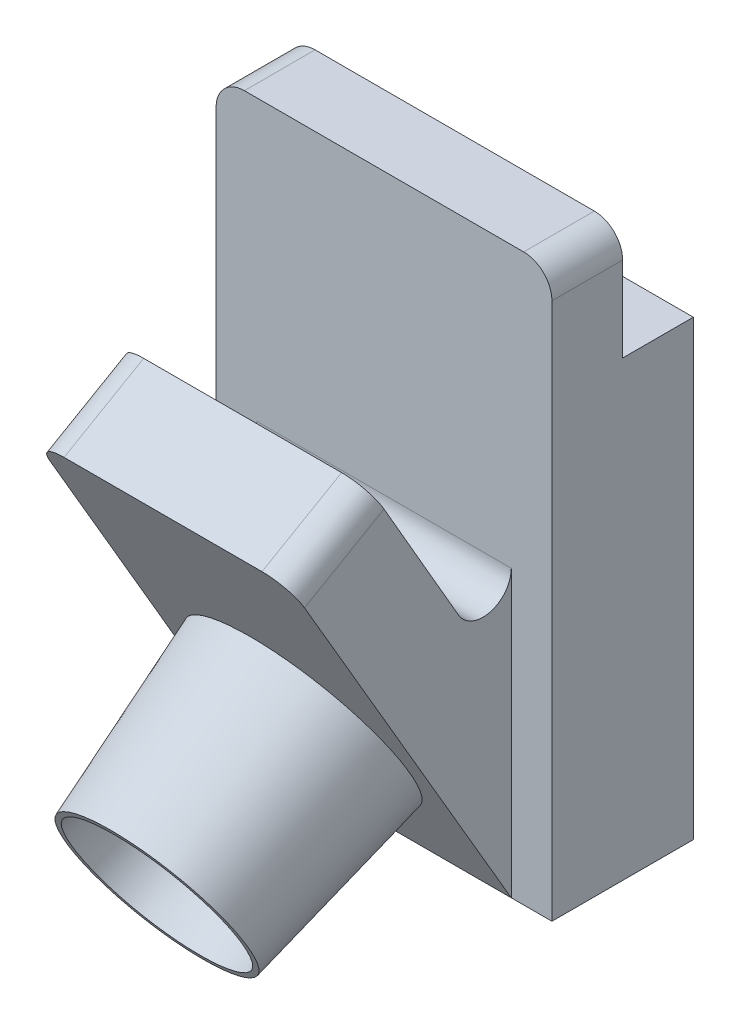
from build123d import *

# Parameters (mm, degrees)
SKETCH2_W           = 23.75
SKETCH2_H           = 32
BOSS_EXTRUDE1_DEPTH = 5
SKETCH3_W           = 23.75
SKETCH3_H           = 40
BOSS_EXTRUDE2_DEPTH = 5
BOSS_EXTRUDE3_START = -11.875
BOSS_EXTRUDE3_DEPTH = 9
SKETCH5_R           = 7.5
SKETCH5_R_2         = 5
BOSS_EXTRUDE4_DEPTH = 12
BOSS_EXTRUDE4_DRAFT = 5
SKETCH6_R           = 5
BOSS_EXTRUDE5_DEPTH = 5
BOSS_EXTRUDE5_TAPER = 45
FILLET1_R           = 2


with BuildPart() as part:
    # Sketch2 → Boss-Extrude1 (new body)
    with BuildSketch(Plane.XY):
        Rectangle(SKETCH2_W, SKETCH2_H)
    extrude(amount=-BOSS_EXTRUDE1_DEPTH)

    # Sketch3 → Boss-Extrude2 (add)
    with BuildSketch(Plane.XY):
        with Locations((0, 4)):
            Rectangle(SKETCH3_W, SKETCH3_H)
    extrude(amount=BOSS_EXTRUDE2_DEPTH)

    # Sketch4 → Boss-Extrude3 (add, symmetric)
    with BuildSketch(Plane(origin=(11.875, 0, 0), x_dir=(0, 0, -1), z_dir=(1, 0, 0)).offset(BOSS_EXTRUDE3_START)):
        Polygon((-5, -3.277778494), (-15, 14.042729581), (-20.629165125, 10.792729581), (-5, -16), align=None)
    extrude(amount=BOSS_EXTRUDE3_DEPTH, both=True)


with BuildPart() as boss_extrude4_tool:
    # Sketch5 → Boss-Extrude4 (with draft: the straight prism first)
    with BuildSketch(Plane(origin=(0, -6.238375225, 10.694307668), x_dir=(1, 0, 0), z_dir=(0, -0.50387277832175, 0.863777878430746))):
        Circle(SKETCH5_R)
        Circle(SKETCH5_R_2, mode=Mode.SUBTRACT)
    extrude(amount=BOSS_EXTRUDE4_DEPTH)
    # Boss-Extrude4: the draft: its side faces are tilted about the plane it starts from
    boss_extrude4_sides = [boss_extrude4_tool.faces().sort_by_distance(p)[0] for p in [
        (-7.5, -9.261611895, 15.876974938),
        (-5, -9.261611895, 15.876974938),
    ]]
    draft(boss_extrude4_sides, Plane(origin=(0, -6.238375225, 10.694307668), x_dir=(1, 0, 0), z_dir=(0, -0.50387277832175, 0.863777878430746)), BOSS_EXTRUDE4_DRAFT)


with BuildPart() as part_1:
    add(part.part)

    # Boss-Extrude4: add boss_extrude4_tool
    add(boss_extrude4_tool.part)

    # Sketch6 → Boss-Extrude5 (add)
    with BuildSketch(Plane(origin=(0, -6.238375225, 10.694307668), x_dir=(1, 0, 0), z_dir=(0, -0.50387277832175, 0.863777878430746))):
        Circle(SKETCH6_R)
    extrude(amount=BOSS_EXTRUDE5_DEPTH, taper=BOSS_EXTRUDE5_TAPER)

    # Fillet1
    fillet1_edges = [part_1.edges().sort_by_distance(p)[0] for p in [
        (-11.875, 24, 2.5),
        (11.875, 24, 2.5),
        (0, -3.277778494, 5),
        (-9, 12.417729581, 17.814582562),
        (9, 12.417729581, 17.814582562),
    ]]
    fillet(fillet1_edges, radius=FILLET1_R)


solid = part_1.part
